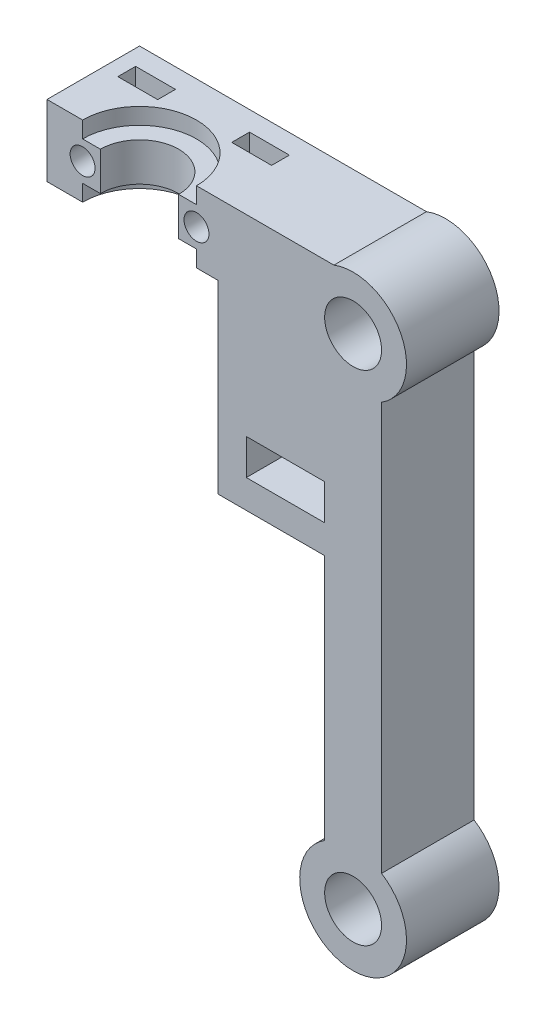
from build123d import *

# Parameters (mm, degrees)
ESBO_O1_R                = 4
ESBO_O1_W                = 11
ESBO_O1_H                = 5
RESSALTO_EXTRUS_O1_DEPTH = 13
RESSALTO_EXTRUS_O3_START = -36
RESSALTO_EXTRUS_O3_DEPTH = 10
CORTE_EXTRUS_O2_START    = -10
ESBO_O7_R                = 8
CORTE_EXTRUS_O2_DEPTH    = 2.3
CORTE_EXTRUS_O3_START    = -2.3
ESBO_O7_2_R              = 8
CORTE_EXTRUS_O3_DEPTH    = 2.3
ESBO_O8_W                = 5.6
ESBO_O8_H                = 2.5
CORTE_EXTRUS_O4_DEPTH    = 10
ESBO_O9_R                = 1.75
CORTE_EXTRUS_O5_DEPTH    = 90.578178146


with BuildPart() as part:
    # Esboço1 → Ressalto-extrusão1 (new body)
    with BuildSketch(Plane.XY):
        with BuildLine():
            Line((4, 63.65571123), (4, 6.34428877))
            ThreePointArc((4, 6.34428877), (0, -7.5), (-4, 6.34428877))
            Line((-4, 6.34428877), (-4, 41))
            Line((-4, 41), (-19, 41))
            Line((-19, 41), (-19, 53))
            Line((-19, 53), (-19, 77))
            Line((-19, 77), (-2.692582404, 77))
            ThreePointArc((-2.692582404, 77), (6.704091727, 73.362313803), (4, 63.65571123))
        make_face()
        with Locations((0, 70)):
            Circle(ESBO_O1_R, mode=Mode.SUBTRACT)
        Circle(ESBO_O1_R, mode=Mode.SUBTRACT)
        with Locations((-9.5, 47.5)):
            Rectangle(ESBO_O1_W, ESBO_O1_H, mode=Mode.SUBTRACT)
    extrude(amount=RESSALTO_EXTRUS_O1_DEPTH)

    # Esboço5 → Ressalto-extrusão3 (add)
    with BuildSketch(Plane.XZ.offset(-41).offset(RESSALTO_EXTRUS_O3_START)):
        with BuildLine():
            Line((-21, 13), (-19, 13))
            Line((-19, 13), (-19, 0))
            Line((-19, 0), (-43, 0))
            Line((-43, 0), (-43, 13))
            Line((-43, 13), (-35.5, 13))
            ThreePointArc((-35.5, 13), (-30, 7.5), (-24.5, 13))
            Line((-24.5, 13), (-21, 13))
        make_face()
    extrude(amount=RESSALTO_EXTRUS_O3_DEPTH)

    # Esboço7 → Corte-extrusão2 (cut)
    with BuildSketch(Plane(origin=(0, 77, 0), x_dir=(1, 0, 0), z_dir=(0, 1, 0)).offset(CORTE_EXTRUS_O2_START)):
        with Locations((-30, -13)):
            Circle(ESBO_O7_R)
    extrude(amount=CORTE_EXTRUS_O2_DEPTH, mode=Mode.SUBTRACT)

    # Esboço7<2> → Corte-extrusão3 (cut)
    with BuildSketch(Plane(origin=(0, 77, 0), x_dir=(1, 0, 0), z_dir=(0, 1, 0)).offset(CORTE_EXTRUS_O3_START)):
        with Locations((-30, -13)):
            Circle(ESBO_O7_2_R)
    extrude(amount=CORTE_EXTRUS_O3_DEPTH, mode=Mode.SUBTRACT)

    # Esboço8 → Corte-extrusão4 (cut)
    with BuildSketch(Plane(origin=(0, 77, 0), x_dir=(1, 0, 0), z_dir=(0, 1, 0))):
        with Locations((-38, -4)):
            Rectangle(ESBO_O8_W, ESBO_O8_H)
        with Locations((-22, -4)):
            Rectangle(ESBO_O8_W, ESBO_O8_H)
    extrude(amount=-CORTE_EXTRUS_O4_DEPTH, mode=Mode.SUBTRACT)

    # Esboço9 → Corte-extrusão5 (cut, through all)
    with BuildSketch(Plane.XY.offset(13)):
        with Locations((-38, 72)):
            Circle(ESBO_O9_R)
        with Locations((-22, 72)):
            Circle(ESBO_O9_R)
    extrude(amount=-CORTE_EXTRUS_O5_DEPTH, mode=Mode.SUBTRACT)


solid = part.part
